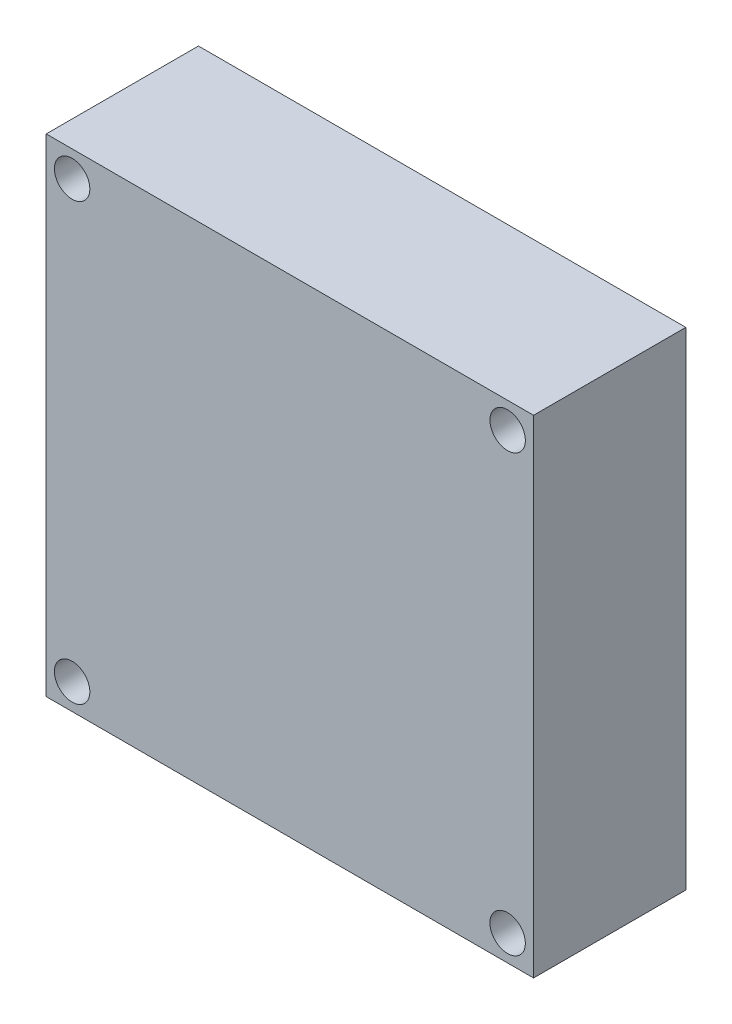
from build123d import *

# Parameters (mm, degrees)
SKETCH1_W           = 80.01
SKETCH1_H           = 80.01
BOSS_EXTRUDE1_DEPTH = 24.9936
SKETCH2_R           = 2.9083
CUT_EXTRUDE1_DEPTH  = 62.850465568


with BuildPart() as part:
    # Sketch1 → Boss-Extrude1 (new body)
    with BuildSketch(Plane.XY):
        Rectangle(SKETCH1_W, SKETCH1_H)
    extrude(amount=BOSS_EXTRUDE1_DEPTH)

    # Sketch2 → Cut-Extrude1 (cut, through all)
    with BuildSketch(Plane.XY.offset(24.9936)):
        with Locations((-35.7505, 35.7505)):
            Circle(SKETCH2_R)
        with Locations((35.7505, 35.7505)):
            Circle(SKETCH2_R)
        with Locations((-35.7505, -35.7505)):
            Circle(SKETCH2_R)
        with Locations((35.7505, -35.7505)):
            Circle(SKETCH2_R)
    extrude(amount=-CUT_EXTRUDE1_DEPTH, mode=Mode.SUBTRACT)


solid = part.part
